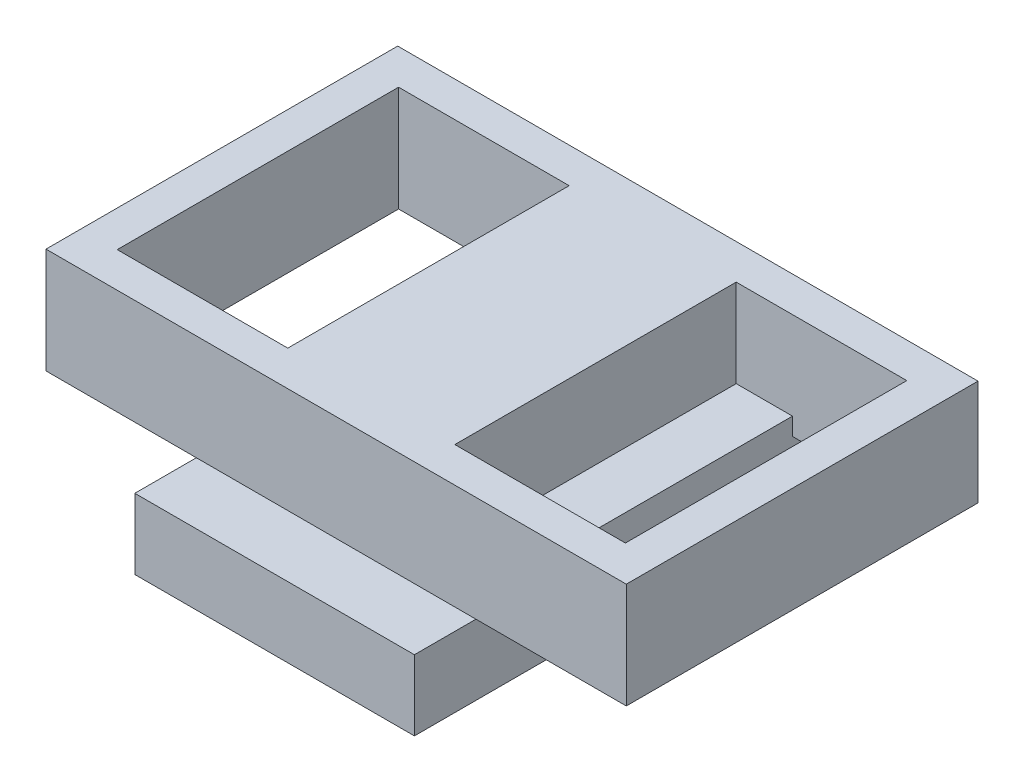
from build123d import *

# Parameters (mm, degrees)
SZKIC1_W                    = 33
SZKIC1_H                    = 20
DODANIE_WYCI_GNI_CIE1_DEPTH = 6
SZKIC2_W                    = 9.7
SZKIC2_H                    = 16
WYTNIJ_WYCI_GNI_CIE1_DEPTH  = 5
SZKIC2_4_W                  = 6.5
SZKIC2_4_H                  = 16
WYTNIJ_WYCI_GNI_CIE2_DEPTH  = 21.205197351
SZKIC3_W                    = 15.9
SZKIC3_H                    = 27
DODANIE_WYCI_GNI_CIE2_DEPTH = 4
SZKIC4_W                    = 10.5
SZKIC4_H                    = 23.5
WYTNIJ_WYCI_GNI_CIE3_DEPTH  = 2.5


with BuildPart() as part:
    # Szkic1 → Dodanie-wyciągnięcie1 (new body)
    with BuildSketch(Plane(origin=(0, 0, 0), x_dir=(1, 0, 0), z_dir=(0, 1, 0))):
        Rectangle(SZKIC1_W, SZKIC1_H)
    extrude(amount=DODANIE_WYCI_GNI_CIE1_DEPTH)

    # Szkic2 → Wytnij-wyciągnięcie1 (cut)
    with BuildSketch(Plane(origin=(0, 6, 0), x_dir=(1, 0, 0), z_dir=(0, 1, 0))):
        with Locations((-9.6, 0)):
            Rectangle(SZKIC2_W, SZKIC2_H)
        with Locations((9.6, 0)):
            Rectangle(SZKIC2_W, SZKIC2_H)
    extrude(amount=-WYTNIJ_WYCI_GNI_CIE1_DEPTH, mode=Mode.SUBTRACT)

    # Szkic2<4> → Wytnij-wyciągnięcie2 (cut, through all)
    with BuildSketch(Plane(origin=(0, 6, 0), x_dir=(1, 0, 0), z_dir=(0, 1, 0))):
        with Locations((-11.2, 0)):
            Rectangle(SZKIC2_4_W, SZKIC2_4_H)
        with Locations((11.2, 0)):
            Rectangle(SZKIC2_4_W, SZKIC2_4_H)
    extrude(amount=-WYTNIJ_WYCI_GNI_CIE2_DEPTH, mode=Mode.SUBTRACT)

    # Szkic3 → Dodanie-wyciągnięcie2 (add)
    with BuildSketch(Plane.XZ):
        Rectangle(SZKIC3_W, SZKIC3_H)
    extrude(amount=DODANIE_WYCI_GNI_CIE2_DEPTH)

    # Szkic4 → Wytnij-wyciągnięcie3 (cut)
    with BuildSketch(Plane.XZ.offset(4)):
        Rectangle(SZKIC4_W, SZKIC4_H)
    extrude(amount=-WYTNIJ_WYCI_GNI_CIE3_DEPTH, mode=Mode.SUBTRACT)


solid = part.part
